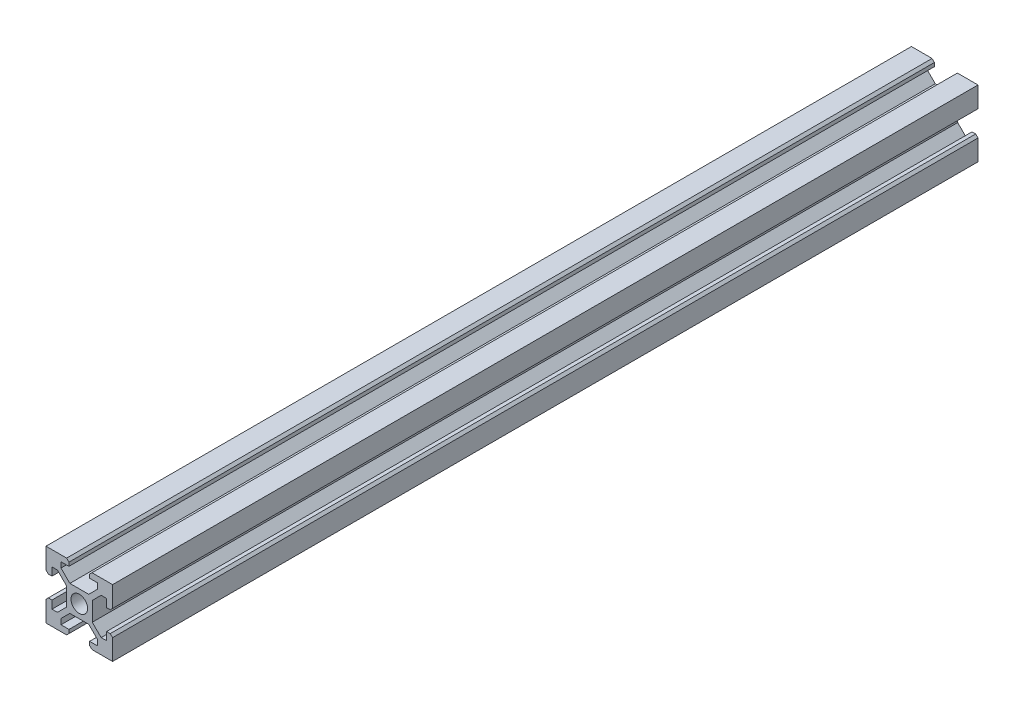
from build123d import *

# Parameters (mm, degrees)
SKETCH1_R           = 2.5
BOSS_EXTRUDE1_DEPTH = 130


with BuildPart() as part:
    # Sketch1 → Boss-Extrude1 (new, symmetric)
    with BuildSketch(Plane.XY):
        Polygon((3.9, -2.839339828), (6.560660172, -5.5), (8.200660172, -5.5), (8.200660172, -3.1), (9.3, -3.1), (10, -3.8), (10, -10), (3.8, -10), (3.1, -9.3), (3.1, -8.200660172), (5.5, -8.200660172), (5.5, -6.560660172), (2.839339828, -3.9), (-2.839339828, -3.9), (-5.5, -6.560660172), (-5.5, -8.200660172), (-3.1, -8.200660172), (-3.1, -9.3), (-3.8, -10), (-10, -10), (-10, -3.8), (-9.3, -3.1), (-8.200660172, -3.1), (-8.200660172, -5.5), (-6.560660172, -5.5), (-3.9, -2.839339828), (-3.9, 2.839339828), (-6.560660172, 5.5), (-8.200660172, 5.5), (-8.200660172, 3.1), (-9.3, 3.1), (-10, 3.8), (-10, 10), (-3.8, 10), (-3.1, 9.3), (-3.1, 8.200660172), (-5.5, 8.200660172), (-5.5, 6.560660172), (-2.839339828, 3.9), (2.839339828, 3.9), (5.5, 6.560660172), (5.5, 8.200660172), (3.1, 8.200660172), (3.1, 9.3), (3.8, 10), (10, 10), (10, 3.8), (9.3, 3.1), (8.200660172, 3.1), (8.200660172, 5.5), (6.560660172, 5.5), (3.9, 2.839339828), align=None)
        Circle(SKETCH1_R, mode=Mode.SUBTRACT)
    extrude(amount=BOSS_EXTRUDE1_DEPTH, both=True)


solid = part.part
